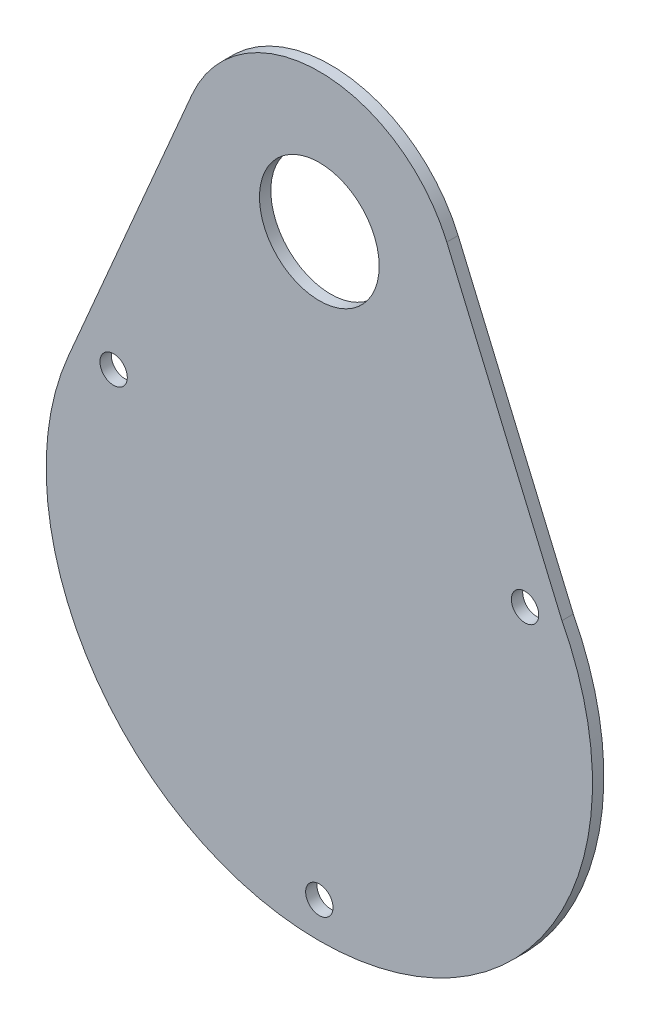
from build123d import *

# Parameters (mm, degrees)
SKETCH1_R           = 1.8288
SKETCH1_R_2         = 8.001
BOSS_EXTRUDE1_DEPTH = 1.51892


with BuildPart() as part:
    # Sketch1 → Boss-Extrude1 (new body)
    with BuildSketch(Plane.XY):
        with BuildLine():
            Line((-60.710673493, 75.845072714), (-77.228514805, 37.338831774))
            ThreePointArc((-77.228514805, 37.338831774), (-42.35630502, -13.543220932), (-11.243869286, 39.720938178))
            Line((-11.243869287, 39.720938178), (-26.6364475, 75.845072714))
            ThreePointArc((-26.6364475, 75.845072714), (-43.673560496, 87.075213498), (-60.710673493, 75.845072714))
        make_face()
        with Locations((-71.169867066, 38.818742375)):
            Circle(SKETCH1_R, mode=Mode.SUBTRACT)
        with Locations((-16.177253926, 38.818742374)):
            Circle(SKETCH1_R, mode=Mode.SUBTRACT)
        with Locations((-43.673560496, 68.536742374)):
            Circle(SKETCH1_R_2, mode=Mode.SUBTRACT)
        with Locations((-43.673560496, -8.806257626)):
            Circle(SKETCH1_R, mode=Mode.SUBTRACT)
    extrude(amount=BOSS_EXTRUDE1_DEPTH)


solid = part.part
